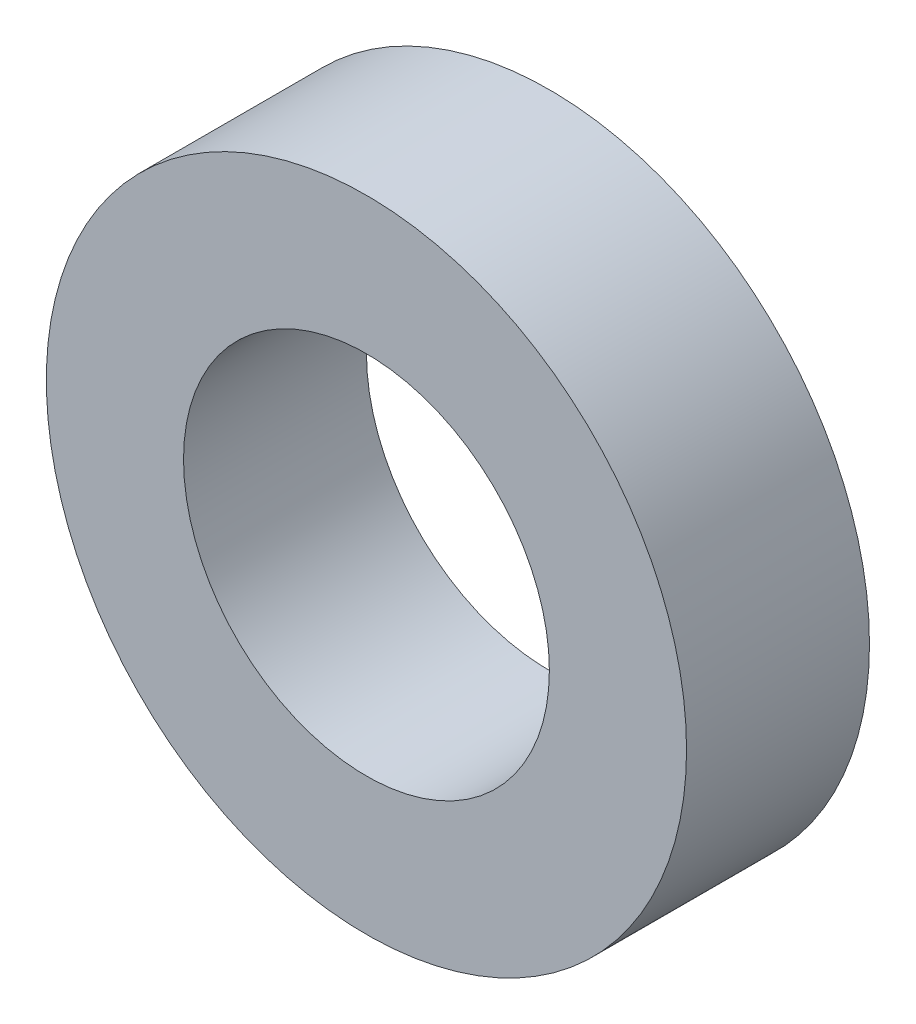
from build123d import *

# Parameters (mm, degrees)
SKETCH1_R           = 11.1125
SKETCH1_R_2         = 6.35
BOSS_EXTRUDE1_DEPTH = 3.175


with BuildPart() as part:
    # Sketch1 → Boss-Extrude1 (new, symmetric)
    with BuildSketch(Plane.XY):
        Circle(SKETCH1_R)
        Circle(SKETCH1_R_2, mode=Mode.SUBTRACT)
    extrude(amount=BOSS_EXTRUDE1_DEPTH, both=True)


solid = part.part
